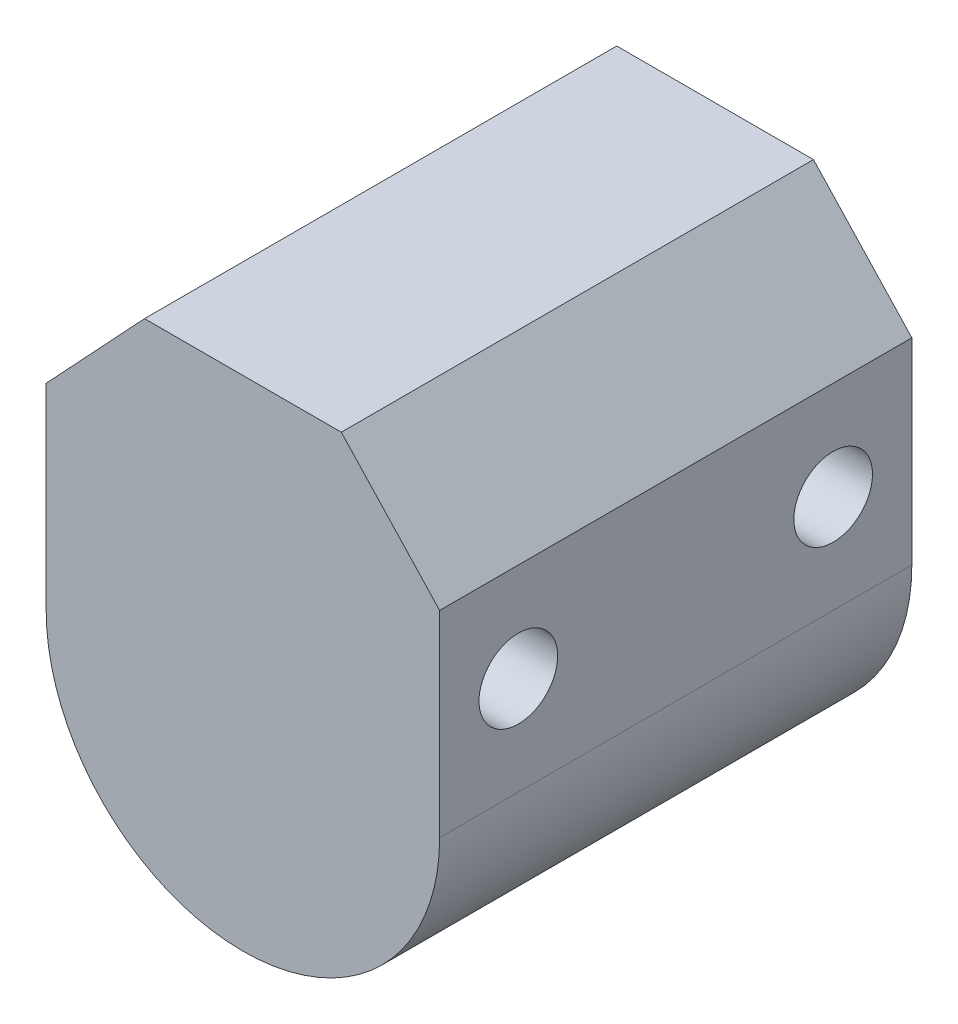
from build123d import *

# Parameters (mm, degrees)
EXTRUDE_3_DEPTH          = 24
CUT_EXTRUDE_1_DEPTH      = 35.805893516
CUT_EXTRUDE_1_DEPTH_BACK = 35.805893516
SKETCH_4_R               = 2


with BuildPart() as part:
    # 草图1 → 凸台-拉伸3 (new body)
    with BuildSketch(Plane.XY):
        with BuildLine():
            Line((0, 10), (0, 0))
            ThreePointArc((0, 0), (2.928932188, 7.071067812), (10, 10))
            Line((10, 10), (10, 15.34438736))
            Line((10, 15.34438736), (5, 15.34438736))
            Line((5, 15.34438736), (0, 10))
        make_face()
        with BuildLine():
            ThreePointArc((10, 10), (17.071067812, 7.071067812), (20, 0))
            Line((20, 0), (20, 10))
            Line((20, 10), (15, 15.34438736))
            Line((15, 15.34438736), (10, 15.34438736))
            Line((10, 15.34438736), (10, 10))
        make_face()
        with BuildLine():
            ThreePointArc((10, 10), (2.928932188, 7.071067812), (0, 0))
            Line((0, 0), (10, 0))
            Line((10, 0), (10, 10))
        make_face()
        with BuildLine():
            Line((10, 10), (10, 0))
            Line((10, 0), (20, 0))
            ThreePointArc((20, 0), (17.071067812, 7.071067812), (10, 10))
        make_face()
        with BuildLine():
            Line((10, 0), (0, 0))
            ThreePointArc((0, 0), (10, -10), (20, 0))
            Line((20, 0), (10, 0))
        make_face()
    extrude(amount=EXTRUDE_3_DEPTH)

    # 草图4 → 切除-拉伸1 (cut, two sides: drawn at the far end of the back side and taken through both)
    with BuildSketch(Plane(origin=(20, 0, 0), x_dir=(0, 0, -1), z_dir=(1, 0, 0)).offset(-CUT_EXTRUDE_1_DEPTH_BACK)):
        with Locations((-20, 5)):
            Circle(SKETCH_4_R)
        with Locations((-4, 5)):
            Circle(SKETCH_4_R)
    extrude(amount=CUT_EXTRUDE_1_DEPTH + CUT_EXTRUDE_1_DEPTH_BACK, mode=Mode.SUBTRACT)


solid = part.part
